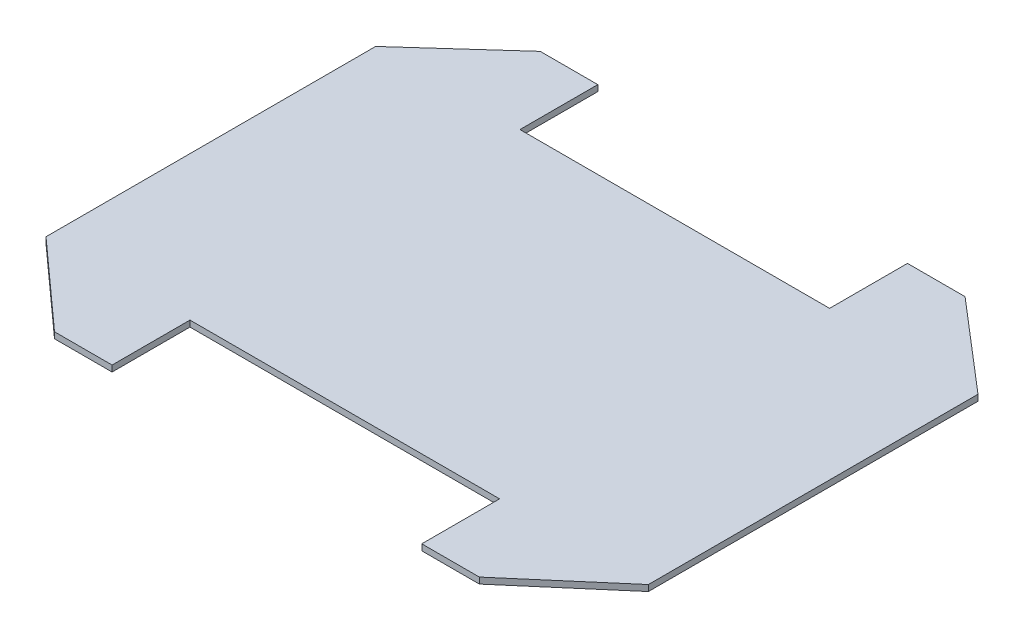
from build123d import *

# Parameters (mm, degrees)
EXTRUDE_1_DEPTH = 5.5


with BuildPart() as part:
    # Эскиз1 → Вытянуть1 (new body)
    with BuildSketch(Plane(origin=(0, 0, 0), x_dir=(1, 0, 0), z_dir=(0, 1, 0))):
        Polygon((-270.759084503, 74.660680838), (-270.759084503, -223.012011978), (-192.586469874, -293.492830448), (-140.586469874, -293.492830448), (-140.586469874, -223.17566557), (139.068300868, -223.17566557), (139.068300868, -293.492830448), (191.068300868, -293.492830448), (273.240915497, -223.012011978), (273.240915497, 74.660680838), (191.068300868, 145.141499308), (139.068300868, 145.141499308), (139.068300868, 74.82433443), (-140.586469874, 74.82433443), (-140.586469874, 145.141499308), (-192.586469874, 145.141499308), align=None)
    extrude(amount=EXTRUDE_1_DEPTH)


solid = part.part
